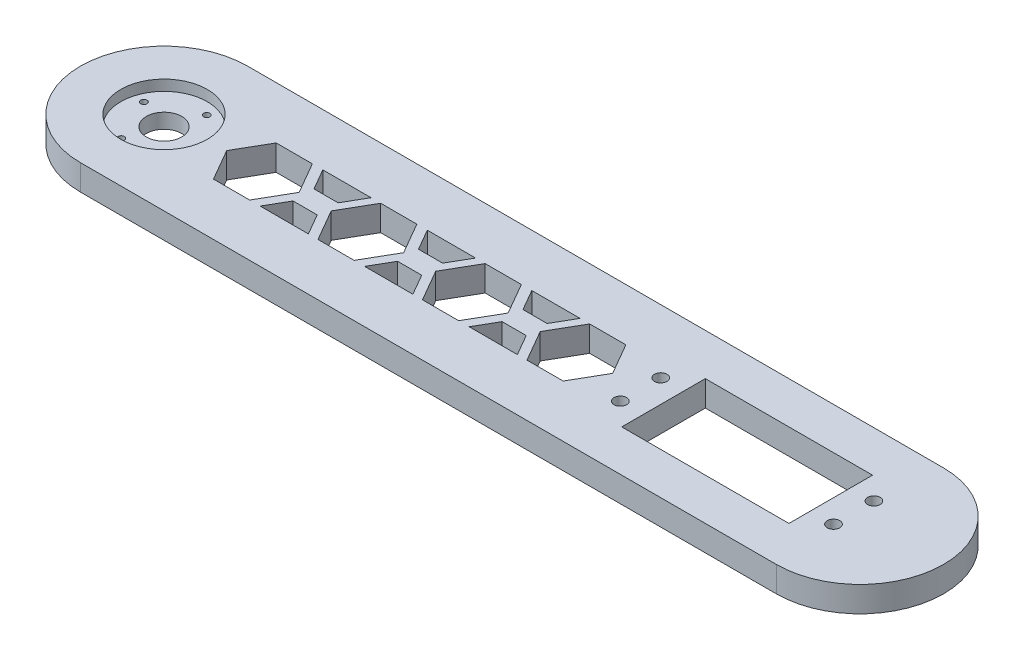
from build123d import *

# Parameters (mm, degrees)
SKETCH1_R           = 4.25
SKETCH1_R_2         = 1.5
SKETCH1_W           = 40
SKETCH1_H           = 20
BOSS_EXTRUDE1_DEPTH = 6.1
SKETCH2_R           = 10.35
CUT_EXTRUDE1_DEPTH  = 2.55
SKETCH3_R           = 0.75
CUT_EXTRUDE3_DEPTH  = 3.55
CUT_EXTRUDE4_DEPTH  = 6.1


with BuildPart() as part:
    # Sketch1 → Boss-Extrude1 (new body)
    with BuildSketch(Plane(origin=(0, 0, 0), x_dir=(1, 0, 0), z_dir=(0, 1, 0))):
        with BuildLine():
            Line((150, 20), (159.5, 20))
            Line((159.5, 20), (166.5, 20))
            ThreePointArc((166.5, 20), (186.5, 0), (166.5, -20))
            Line((166.5, -20), (159.5, -20))
            Line((159.5, -20), (150, -20))
            Line((150, -20), (0, -20))
            ThreePointArc((0, -20), (-20, 0), (0, 20))
            Line((0, 20), (150, 20))
        make_face()
        with Locations(Location((0, 0, 0), (0, 0, 270))):
            Circle(SKETCH1_R, mode=Mode.SUBTRACT)
        with Locations(Location((165, 4.825, 0), (0, 0, 270))):
            Circle(SKETCH1_R_2, mode=Mode.SUBTRACT)
        with Locations(Location((165, -4.825, 0), (0, 0, 270))):
            Circle(SKETCH1_R_2, mode=Mode.SUBTRACT)
        with Locations(Location((114, 4.825, 0), (0, 0, 270))):
            Circle(SKETCH1_R_2, mode=Mode.SUBTRACT)
        with Locations(Location((114, -4.825, 0), (0, 0, 270))):
            Circle(SKETCH1_R_2, mode=Mode.SUBTRACT)
        with Locations((139.5, 0)):
            Rectangle(SKETCH1_W, SKETCH1_H, mode=Mode.SUBTRACT)
    extrude(amount=BOSS_EXTRUDE1_DEPTH)

    # Sketch2 → Cut-Extrude1 (cut)
    with BuildSketch(Plane(origin=(0, 6.1, 0), x_dir=(1, 0, 0), z_dir=(0, 1, 0))):
        with Locations(Location((0, 0, 0), (0, 0, 270))):
            Circle(SKETCH2_R)
    extrude(amount=-CUT_EXTRUDE1_DEPTH, mode=Mode.SUBTRACT)

    # Sketch3 → Cut-Extrude3 (cut)
    with BuildSketch(Plane(origin=(0, 3.55, 0), x_dir=(1, 0, 0), z_dir=(0, 1, 0))):
        with Locations(Location((-7.52500865, 2.715556079, 0), (0, 0, 270))):
            Circle(SKETCH3_R)
        with Locations(Location((7.52500865, -2.715556079, 0), (0, 0, 270))):
            Circle(SKETCH3_R)
        with Locations(Location((2.715556079, 7.52500865, 0), (0, 0, 270))):
            Circle(SKETCH3_R)
        with Locations(Location((-2.715556079, -7.52500865, 0), (0, 0, 270))):
            Circle(SKETCH3_R)
    extrude(amount=-CUT_EXTRUDE3_DEPTH, mode=Mode.SUBTRACT)

    # Sketch4 → Cut-Extrude4 (cut)
    with BuildSketch(Plane(origin=(0, 6.1, 0), x_dir=(1, 0, 0), z_dir=(0, 1, 0))):
        Polygon((32.320508076, 0), (27.990381057, 7.5), (19.330127019, 7.5), (15, 0), (19.330127019, -7.5), (27.990381057, -7.5), align=None)
        Polygon((57.320508076, 0), (52.990381057, 7.5), (44.330127019, 7.5), (40, 0), (44.330127019, -7.5), (52.990381057, -7.5), align=None)
        Polygon((82.320508076, 0), (77.990381057, 7.5), (69.330127019, 7.5), (65, 0), (69.330127019, -7.5), (77.990381057, -7.5), align=None)
        Polygon((107.320508076, 0), (102.990381057, 7.5), (94.330127019, 7.5), (90, 0), (94.330127019, -7.5), (102.990381057, -7.5), align=None)
        Polygon((30.490381057, 7.5), (42.037386441, 7.5), (39.150635095, 2.5), (33.377132403, 2.5), align=None)
        Polygon((64.150635095, 2.5), (67.037386441, 7.5), (55.490381057, 7.5), (58.377132403, 2.5), align=None)
        Polygon((89.150635095, 2.5), (92.037386441, 7.5), (80.490381057, 7.5), (83.377132403, 2.5), align=None)
        Polygon((30.490381057, -7.5), (42.037386441, -7.5), (39.150635095, -2.5), (33.377132403, -2.5), align=None)
        Polygon((55.490381057, -7.5), (67.037386441, -7.5), (64.150635095, -2.5), (58.377132403, -2.5), align=None)
        Polygon((80.490381057, -7.5), (92.037386441, -7.5), (89.150635095, -2.5), (83.377132403, -2.5), align=None)
    extrude(amount=-CUT_EXTRUDE4_DEPTH, mode=Mode.SUBTRACT)


solid = part.part
